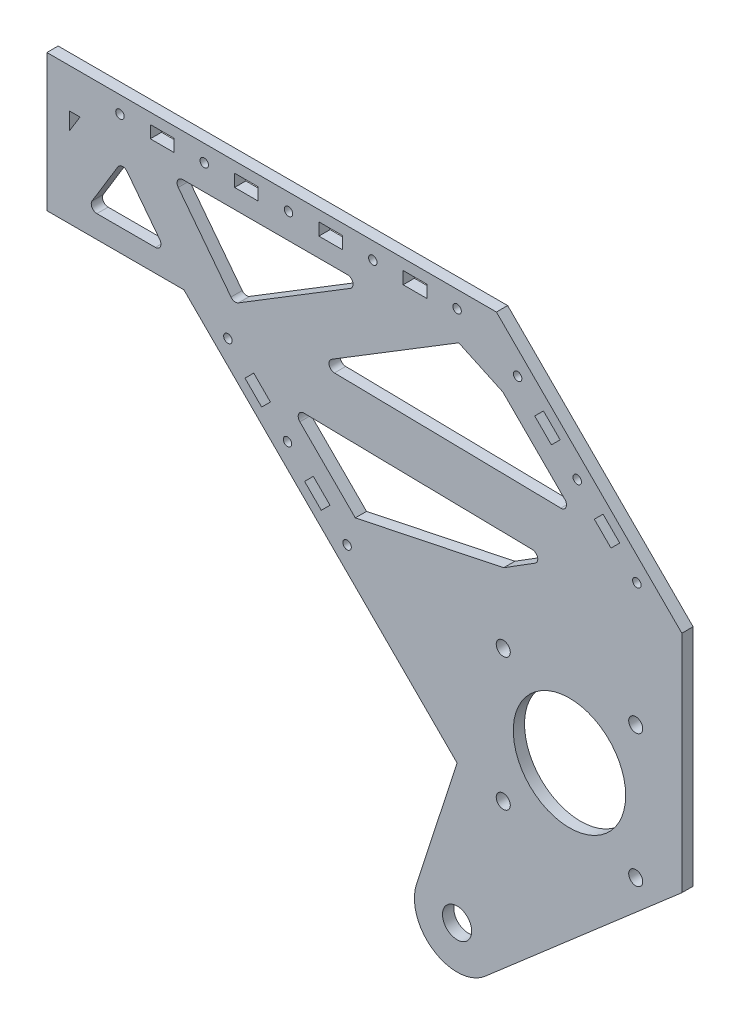
from build123d import *

# Parameters (mm, degrees)
SKETCH_1_R          = 1.5
SKETCH_1_R_2        = 20
SKETCH_1_R_3        = 5.2
SKETCH_1_R_4        = 2.5
SKETCH_1_W          = 8.4
SKETCH_1_H          = 4.4
EXTRUDE_1_DEPTH     = 4
CUT_EXTRUDE_1_DEPTH = 10


with BuildPart() as part:
    # 草图1 → 凸台-拉伸1 (new body)
    with BuildSketch(Plane.XY):
        with BuildLine():
            Line((-138.972571837, 141.054738201), (21.027428163, 141.054738201))
            Line((21.027428163, 141.054738201), (87.027428163, 75.054738201))
            Line((87.027428163, 75.054738201), (87.027428163, -4.945261799))
            Line((87.027428163, -4.945261799), (16.988248923, -65.708672494))
            ThreePointArc((16.988248923, -65.708672494), (-1.364322077, -66.900830621), (-7.431532599, -49.539175751))
            Line((-7.431532599, -49.539175751), (7.027428163, -4.945261799))
            Line((7.027428163, -4.945261799), (-90.203942848, 92.286109212))
            Line((-90.203942848, 92.286109212), (-138.972571837, 92.286109212))
            Line((-138.972571837, 92.286109212), (-138.972571837, 141.054738201))
        make_face()
        with Locations((-52.972571837, 135.054738201)):
            Circle(SKETCH_1_R, mode=Mode.SUBTRACT)
        with Locations((47.027428163, 15.054738201)):
            Circle(SKETCH_1_R_2, mode=Mode.SUBTRACT)
        with Locations(Location((-22.972571837, 135.054738201, 0), (0, 0, 180))):
            Circle(SKETCH_1_R, mode=Mode.SUBTRACT)
        with Locations((7.027428163, 135.054738201)):
            Circle(SKETCH_1_R, mode=Mode.SUBTRACT)
        with Locations(Location((-112.972571837, 135.054738201, 0), (0, 0, 180))):
            Circle(SKETCH_1_R, mode=Mode.SUBTRACT)
        with Locations((-82.972571837, 135.054738201)):
            Circle(SKETCH_1_R, mode=Mode.SUBTRACT)
        with Locations((7.027428163, -54.227294102)):
            Circle(SKETCH_1_R_3, mode=Mode.SUBTRACT)
        with Locations((49.784787476, 103.812097514)):
            Circle(SKETCH_1_R, mode=Mode.SUBTRACT)
        with Locations(Location((70.997990912, 82.598894078, 0), (0, 0, 180))):
            Circle(SKETCH_1_R, mode=Mode.SUBTRACT)
        with Locations(Location((28.571584041, 125.025300949, 0), (0, 0, 180))):
            Circle(SKETCH_1_R, mode=Mode.SUBTRACT)
        with Locations((-53.337194475, 63.904642213)):
            Circle(SKETCH_1_R, mode=Mode.SUBTRACT)
        with Locations(Location((-32.123991039, 42.691438778, 0), (0, 0, 180))):
            Circle(SKETCH_1_R, mode=Mode.SUBTRACT)
        with Locations(Location((-74.55039791, 85.117845649, 0), (0, 0, 180))):
            Circle(SKETCH_1_R, mode=Mode.SUBTRACT)
        with Locations((70.597428163, 38.624738201)):
            Circle(SKETCH_1_R_4, mode=Mode.SUBTRACT)
        with Locations((70.597428163, -8.515261799)):
            Circle(SKETCH_1_R_4, mode=Mode.SUBTRACT)
        with Locations((23.457428163, -8.515261799)):
            Circle(SKETCH_1_R_4, mode=Mode.SUBTRACT)
        with Locations((23.457428163, 38.624738201)):
            Circle(SKETCH_1_R_4, mode=Mode.SUBTRACT)
        with Locations((-37.972571837, 135.054738201)):
            Rectangle(SKETCH_1_W, SKETCH_1_H, mode=Mode.SUBTRACT)
        with Locations((-7.972571837, 135.054738201)):
            Rectangle(SKETCH_1_W, SKETCH_1_H, mode=Mode.SUBTRACT)
        with Locations((-97.972571837, 135.054738201)):
            Rectangle(SKETCH_1_W, SKETCH_1_H, mode=Mode.SUBTRACT)
        with Locations((-67.972571837, 135.054738201)):
            Rectangle(SKETCH_1_W, SKETCH_1_H, mode=Mode.SUBTRACT)
        Polygon((55.865905794, 94.619709358), (61.805602756, 88.680012396), (64.916872594, 91.791282234), (58.977175632, 97.730979196), align=None, mode=Mode.SUBTRACT)
        Polygon((34.652702359, 115.832912794), (37.763972196, 118.944182631), (43.703669158, 113.004485669), (40.592399321, 109.893215832), align=None, mode=Mode.SUBTRACT)
        Polygon((-47.256076157, 54.712254058), (-41.316379195, 48.772557096), (-38.205109357, 51.883826933), (-44.144806319, 57.823523895), align=None, mode=Mode.SUBTRACT)
        Polygon((-68.469279592, 75.925457494), (-65.358009755, 79.036727331), (-59.418312793, 73.097030369), (-62.52958263, 69.985760532), align=None, mode=Mode.SUBTRACT)
    extrude(amount=EXTRUDE_1_DEPTH)

    # 草图2 → 切除-拉伸1 (cut)
    with BuildSketch(Plane(origin=(0, 0, 0), x_dir=(-1, 0, 0), z_dir=(0, 0, -1))):
        with BuildLine():
            Line((98.792246858, 103.505713788), (110.418981679, 118.616857906))
            ThreePointArc((110.418981679, 118.616857906), (112.113620797, 119.394251765), (113.713072721, 118.436182616))
            Line((113.713072721, 118.436182616), (122.899473042, 103.325038498))
            ThreePointArc((122.899473042, 103.325038498), (122.933741653, 101.305767071), (121.190489151, 100.286109212))
            Line((121.190489151, 100.286109212), (100.377354008, 100.286109212))
            ThreePointArc((100.377354008, 100.286109212), (98.583028348, 101.402709289), (98.792246858, 103.505713788))
        make_face()
        Polygon((127.198237985, 127.054738201), (130.972571837, 120.84615804), (130.972571837, 127.054738201), align=None)
        with BuildLine():
            Line((73.446278945, 98.44171591), (92.214930542, 122.835133626))
            ThreePointArc((92.214930542, 122.835133626), (92.424149051, 124.938138124), (90.629823391, 126.054738201))
            Line((90.629823391, 126.054738201), (32.011635988, 126.054738201))
            ThreePointArc((32.011635988, 126.054738201), (30.086594754, 124.59715524), (30.967460822, 122.348954445))
            Line((30.967460822, 122.348954445), (70.816996628, 97.955536729))
            ThreePointArc((70.816996628, 97.955536729), (72.224826028, 97.694659457), (73.446278945, 98.44171591))
        make_face()
        with BuildLine():
            Line((36.616706696, 93.462689168), (-43.937662379, 92.068564807))
            ThreePointArc((-43.937662379, 92.068564807), (-45.813338133, 93.286939697), (-45.386484011, 95.482478917))
            Line((-45.386484011, 95.482478917), (-23.33185922, 117.537103709))
            Line((-23.33185922, 117.537103709), (-7.607283327, 124.857355573))
            Line((-7.607283327, 124.857355573), (37.626273792, 97.168173472))
            ThreePointArc((37.626273792, 97.168173472), (38.51176098, 94.936649095), (36.616706696, 93.462689168))
        make_face()
        with BuildLine():
            Line((29.20140553, 52.49677533), (-23.612246698, 63.53541151))
            Line((-23.612246698, 63.53541151), (-34.805439363, 70.547080779))
            ThreePointArc((-34.805439363, 70.547080779), (-35.670630649, 72.777688158), (-33.778316178, 74.241693343))
            Line((-33.778316178, 74.241693343), (47.490069377, 75.64817492))
            ThreePointArc((47.490069377, 75.64817492), (49.365745131, 74.42980003), (48.93889101, 72.23426081))
            Line((48.93889101, 72.23426081), (29.20140553, 52.49677533))
        make_face()
    extrude(amount=-CUT_EXTRUDE_1_DEPTH, mode=Mode.SUBTRACT)


solid = part.part
